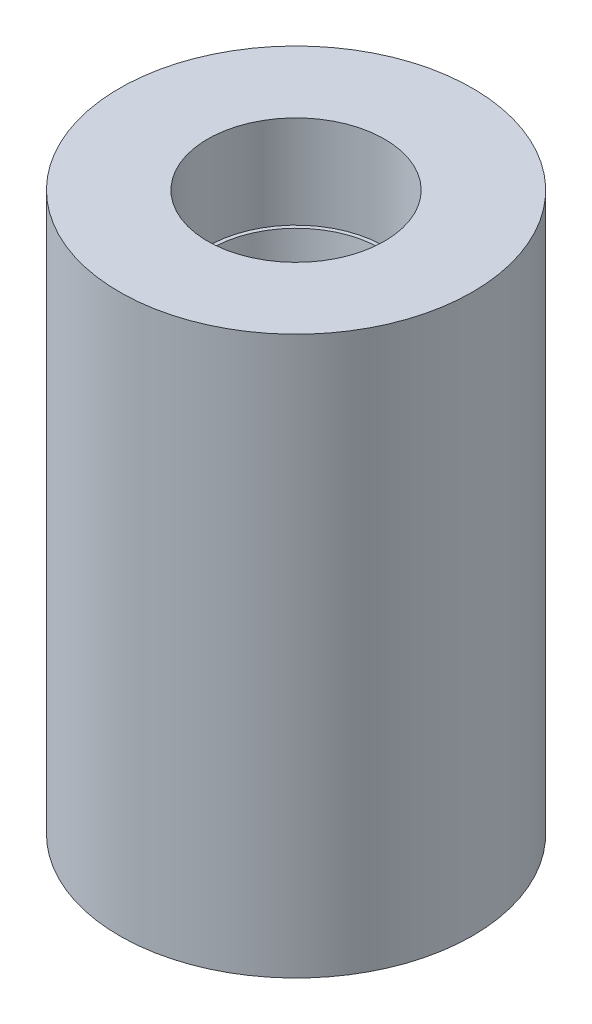
from build123d import *

# Parameters (mm, degrees)
CUT_EXTRUDE2_START = -22.2
SKETCH4_R          = 1.1
SKETCH4_R_2        = 0.9
CUT_EXTRUDE2_DEPTH = 8


with BuildPart() as part:
    # Sketch1 → Revolve1 (revolve)
    with BuildSketch(Plane.XY):
        Polygon((4.762351203, 30), (4.762351203, 25), (4.559151203, 25), (2.05, 0), (9.5, -0.008522661), (9.5, 30), align=None)
    revolve(axis=Axis((0, 0, 0), (0, 1, 0)))

    # Sketch4 → Cut-Extrude2 (cut)
    with BuildSketch(Plane(origin=(0, 30, 0), x_dir=(1, 0, 0), z_dir=(0, 1, 0)).offset(CUT_EXTRUDE2_START)):
        with Locations(Location((0, 7.145, 0), (0, 0, 180))):
            Circle(SKETCH4_R)
        with Locations(Location((7.145, 0, 0), (0, 0, 180))):
            Circle(SKETCH4_R)
        with Locations(Location((0, -7.145, 0), (0, 0, 180))):
            Circle(SKETCH4_R)
        with Locations(Location((-7.145, 0, 0), (0, 0, 180))):
            Circle(SKETCH4_R)
        with Locations(Location((5.052277952, 5.052277952, 0), (0, 0, 180))):
            Circle(SKETCH4_R_2)
        with Locations(Location((5.052277952, -5.052277952, 0), (0, 0, 180))):
            Circle(SKETCH4_R_2)
        with Locations(Location((-5.052277952, -5.052277952, 0), (0, 0, 180))):
            Circle(SKETCH4_R_2)
        with Locations(Location((-5.052277952, 5.052277952, 0), (0, 0, 180))):
            Circle(SKETCH4_R_2)
    extrude(amount=-CUT_EXTRUDE2_DEPTH, mode=Mode.SUBTRACT)


solid = part.part
